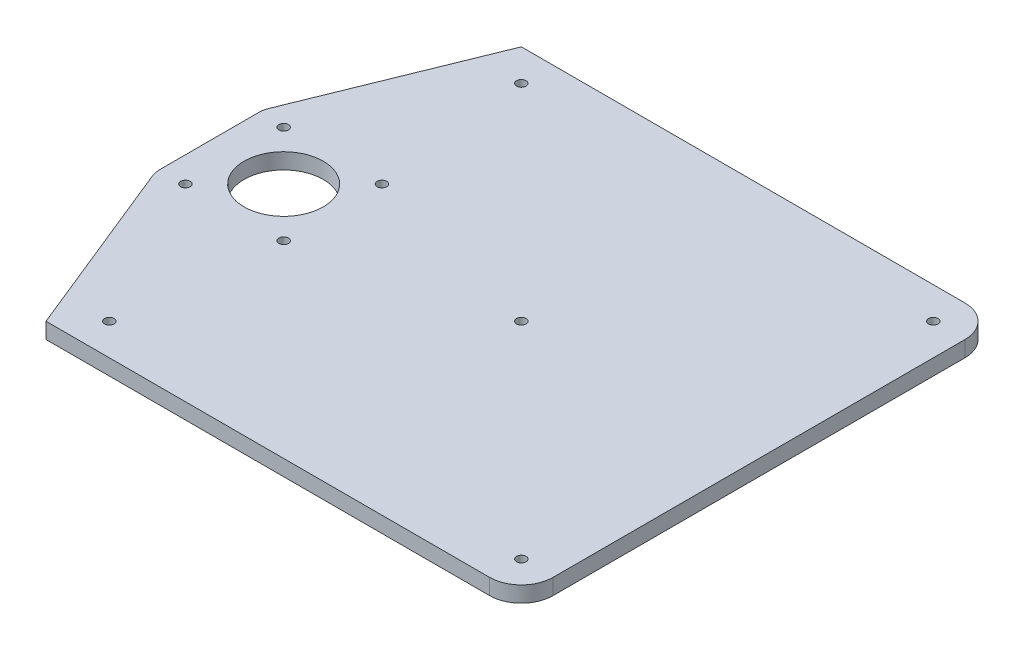
from build123d import *

# Parameters (mm, degrees)
SKETCH1_R           = 1.5
SKETCH1_R_2         = 12.5
BOSS_EXTRUDE1_DEPTH = 5


with BuildPart() as part:
    # Sketch1 → Boss-Extrude1 (new body)
    with BuildSketch(Plane(origin=(0, 0, 0), x_dir=(1, 0, 0), z_dir=(0, 1, 0))):
        with BuildLine():
            Line((-75, -75), (65, -75))
            ThreePointArc((65, -75), (72.071067812, -72.071067812), (75, -65))
            Line((75, -65), (75, 65))
            ThreePointArc((75, 65), (72.071067812, 72.071067812), (65, 75))
            Line((65, 75), (-75, 75))
            Line((-75, 75), (-97.913420794, 18.506857518))
            ThreePointArc((-97.913420794, 18.506857518), (-98.351985938, 17.031769181), (-98.5, 15.5))
            Line((-98.5, 15.5), (-98.5, -15.5))
            ThreePointArc((-98.5, -15.5), (-98.351985938, -17.031769181), (-97.913420794, -18.506857518))
            Line((-97.913420794, -18.506857518), (-75, -75))
        make_face()
        with Locations(Location((-90.5, 15.5, 0), (0, 0, 270))):
            Circle(SKETCH1_R, mode=Mode.SUBTRACT)
        with Locations(Location((-90.5, -15.5, 0), (0, 0, 270))):
            Circle(SKETCH1_R, mode=Mode.SUBTRACT)
        with Locations(Location((-59.5, -15.5, 0), (0, 0, 270))):
            Circle(SKETCH1_R, mode=Mode.SUBTRACT)
        with Locations(Location((-59.5, 15.5, 0), (0, 0, 270))):
            Circle(SKETCH1_R, mode=Mode.SUBTRACT)
        with Locations(Location((-75, 0, 0), (0, 0, 270))):
            Circle(SKETCH1_R_2, mode=Mode.SUBTRACT)
        with Locations(Location((-65, 65, 0), (0, 0, 270))):
            Circle(SKETCH1_R, mode=Mode.SUBTRACT)
        with Locations(Location((65, 65, 0), (0, 0, 270))):
            Circle(SKETCH1_R, mode=Mode.SUBTRACT)
        with Locations(Location((65, -65, 0), (0, 0, 270))):
            Circle(SKETCH1_R, mode=Mode.SUBTRACT)
        with Locations(Location((-65, -65, 0), (0, 0, 270))):
            Circle(SKETCH1_R, mode=Mode.SUBTRACT)
        with Locations(Location((0, 0, 0), (0, 0, 270))):
            Circle(SKETCH1_R, mode=Mode.SUBTRACT)
    extrude(amount=BOSS_EXTRUDE1_DEPTH)


solid = part.part
